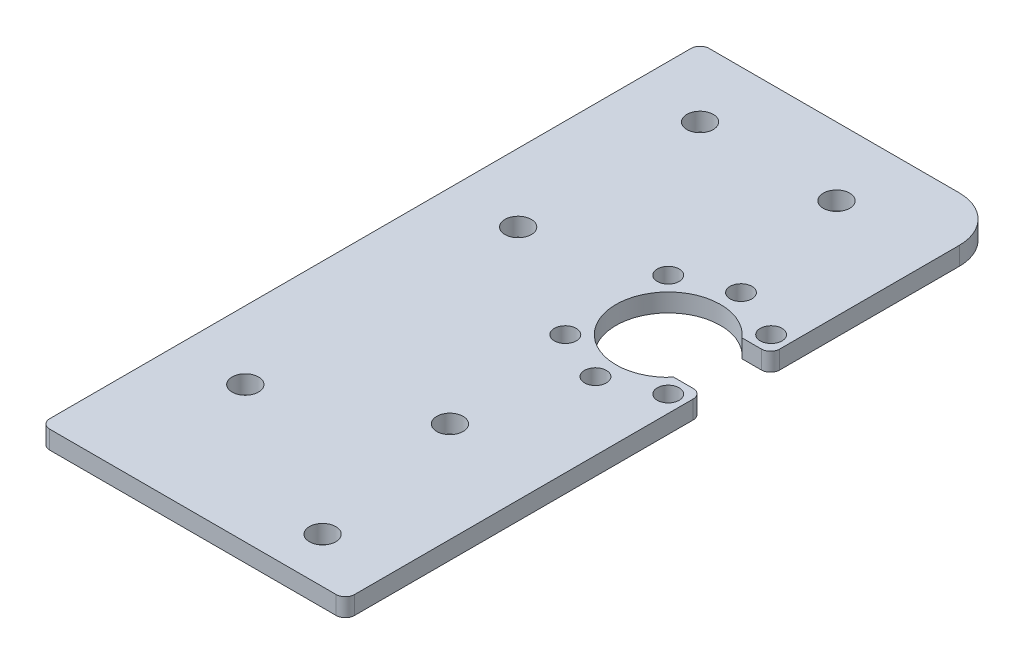
from build123d import *

# Parameters (mm, degrees)
SKETCH1_W           = 67
SKETCH1_H           = 145
BOSS_EXTRUDE1_DEPTH = 4
CUT_EXTRUDE1_DEPTH  = 160.781100259
SKETCH4_R           = 2.4
CUT_EXTRUDE2_DEPTH  = 160.781100259
SKETCH5_R           = 2.9
CUT_EXTRUDE3_DEPTH  = 160.781100259
FILLET1_R           = 10
FILLET2_R           = 2


with BuildPart() as part:
    # Sketch1 → Boss-Extrude1 (new body)
    with BuildSketch(Plane(origin=(0, 0, 0), x_dir=(1, 0, 0), z_dir=(0, 1, 0))):
        with Locations((33.5, 72.5)):
            Rectangle(SKETCH1_W, SKETCH1_H)
    extrude(amount=BOSS_EXTRUDE1_DEPTH)

    # Sketch2 → Cut-Extrude1 (cut, through all)
    with BuildSketch(Plane(origin=(0, 4, 0), x_dir=(1, 0, 0), z_dir=(0, 1, 0))):
        with BuildLine():
            Line((67, 78.5), (67, 93.5))
            Line((67, 93.5), (60.717797887, 93.5))
            ThreePointArc((60.717797887, 93.5), (40.5, 86), (60.717797887, 78.5))
            Line((60.717797887, 78.5), (67, 78.5))
        make_face()
    extrude(amount=-CUT_EXTRUDE1_DEPTH, mode=Mode.SUBTRACT)

    # Sketch4 → Cut-Extrude2 (cut, through all)
    with BuildSketch(Plane(origin=(0, 4, 0), x_dir=(1, 0, 0), z_dir=(0, 1, 0))):
        with Locations(Location((63.31370855, 74.68629145, 0), (0, 0, 270))):
            Circle(SKETCH4_R)
        with Locations(Location((52, 69.999999928, 0), (0, 0, 270))):
            Circle(SKETCH4_R)
        with Locations(Location((40.68629145, 74.68629145, 0), (0, 0, 270))):
            Circle(SKETCH4_R)
        with Locations(Location((40.68629145, 97.31370855, 0), (0, 0, 270))):
            Circle(SKETCH4_R)
        with Locations(Location((52, 102.000000072, 0), (0, 0, 270))):
            Circle(SKETCH4_R)
        with Locations(Location((63.31370855, 97.31370855, 0), (0, 0, 270))):
            Circle(SKETCH4_R)
    extrude(amount=-CUT_EXTRUDE2_DEPTH, mode=Mode.SUBTRACT)

    # Sketch5 → Cut-Extrude3 (cut, through all)
    with BuildSketch(Plane(origin=(0, 4, 0), x_dir=(1, 0, 0), z_dir=(0, 1, 0))):
        with Locations(Location((15, 130, 0), (0, 0, 270))):
            Circle(SKETCH5_R)
        with Locations(Location((15, 90, 0), (0, 0, 270))):
            Circle(SKETCH5_R)
        with Locations(Location((52, 10, 0), (0, 0, 270))):
            Circle(SKETCH5_R)
        with Locations(Location((15, 30, 0), (0, 0, 270))):
            Circle(SKETCH5_R)
        with Locations(Location((45, 130, 0), (0, 0, 270))):
            Circle(SKETCH5_R)
        with Locations(Location((45, 45, 0), (0, 0, 270))):
            Circle(SKETCH5_R)
    extrude(amount=-CUT_EXTRUDE3_DEPTH, mode=Mode.SUBTRACT)

    # Fillet1
    fillet1_edges = [part.edges().sort_by_distance(p)[0] for p in [
        (67, 2, -145),
    ]]
    fillet(fillet1_edges, radius=FILLET1_R)

    # Fillet2
    fillet2_edges = [part.edges().sort_by_distance(p)[0] for p in [
        (67, 2, -93.5),
        (67, 2, -78.5),
        (0, 2, -145),
        (67, 2, 0),
        (0, 2, 0),
    ]]
    fillet(fillet2_edges, radius=FILLET2_R)


solid = part.part
